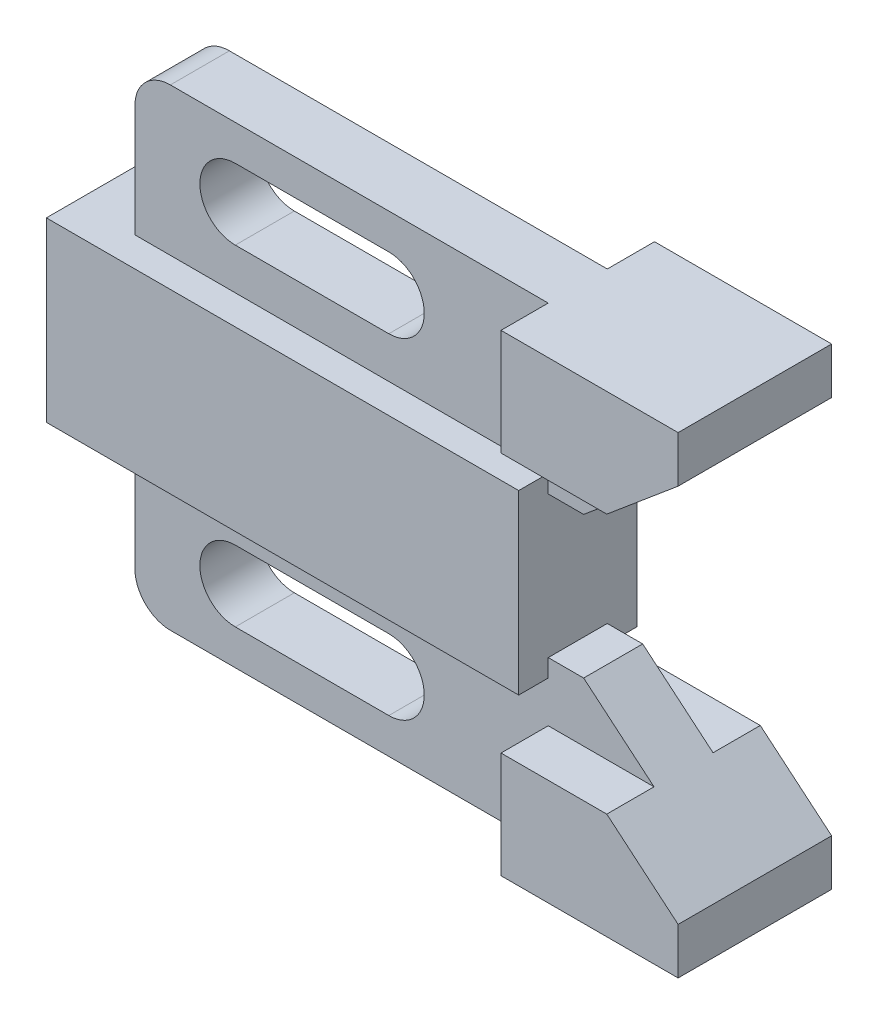
from build123d import *

# Parameters (mm, degrees)
BOSS_EXTRUDE1_DEPTH  = 12.5
SKETCH3_W            = 200
SKETCH3_H            = 75
BOSS_EXTRUDE2_DEPTH  = 25
BOSS_EXTRUDE3_DEPTH  = 20
MIRROR2_COPY_1_DEPTH = 20
FILLET2_R            = 15


with BuildPart() as part:
    # Sketch1 → Boss-Extrude1 (new, symmetric)
    with BuildSketch(Plane.XY):
        Polygon((0, 0), (250, 0), (250, -19.654022129), (190, -70), (150, -70), (150, -130), (190, -130), (250, -180.345977871), (250, -200), (0, -200), align=None)
        with BuildLine():
            Line((42.5, -15), (107.5, -15))
            ThreePointArc((107.5, -15), (122.5, -30), (107.5, -45))
            Line((107.5, -45), (42.5, -45))
            ThreePointArc((42.5, -45), (27.5, -30), (42.5, -15))
        make_face(mode=Mode.SUBTRACT)
        with BuildLine():
            Line((42.5, -185), (107.5, -185))
            ThreePointArc((107.5, -185), (122.5, -170), (107.5, -155))
            Line((107.5, -155), (42.5, -155))
            ThreePointArc((42.5, -155), (27.5, -170), (42.5, -185))
        make_face(mode=Mode.SUBTRACT)
    extrude(amount=BOSS_EXTRUDE1_DEPTH, both=True)

    # Sketch3 → Boss-Extrude2 (add, symmetric)
    with BuildSketch(Plane.XY):
        with Locations((75, -100)):
            Rectangle(SKETCH3_W, SKETCH3_H)
    extrude(amount=BOSS_EXTRUDE2_DEPTH, both=True)

    # Sketch4 → Boss-Extrude3 (add)
    with BuildSketch(Plane.XY.offset(12.5)):
        Polygon((250, 0), (175, 0), (175, -45), (219.793839815, -45), (250, -19.654022129), align=None)
    boss_extrude3 = extrude(amount=BOSS_EXTRUDE3_DEPTH)

    # Mirror1: Boss-Extrude3 across plane
    add(boss_extrude3.mirror(Plane.ZX.offset(-100)))

    # Mirror2: Boss-Extrude3 across plane
    add(boss_extrude3.mirror(Plane.XY))

    # Mirror2 copy 1 sketch → Mirror2 copy 1 (add)
    with BuildSketch(Plane(origin=(0, -200, -12.5), x_dir=(1, 0, 0), z_dir=(0, 0, -1))):
        Polygon((250, 0), (175, 0), (175, -45), (219.793839815, -45), (250, -19.654022129), align=None)
    extrude(amount=MIRROR2_COPY_1_DEPTH)

    # Fillet2
    fillet2_edges = [part.edges().sort_by_distance(p)[0] for p in [
        (0, 0, 0),
        (0, -200, 0),
    ]]
    fillet(fillet2_edges, radius=FILLET2_R)


solid = part.part
